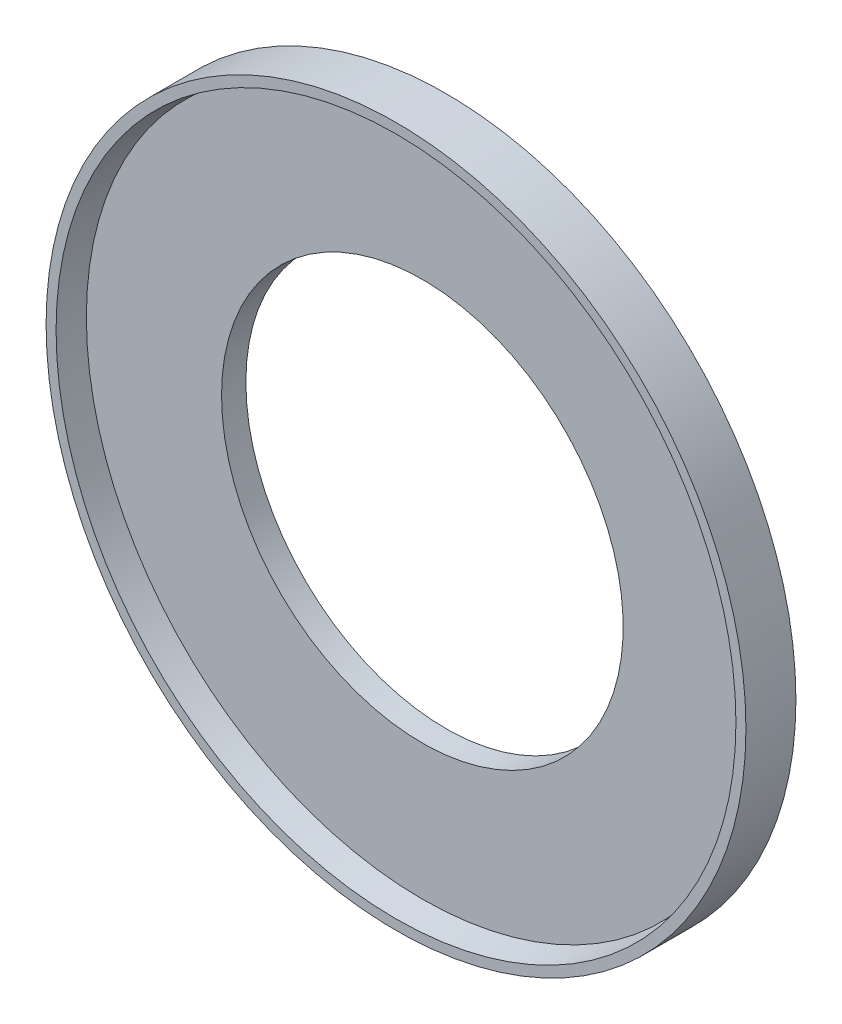
from build123d import *


with BuildPart() as part:
    # 스케치2 → 회전1 (revolve)
    with BuildSketch(Plane(origin=(0, 0, 0), x_dir=(1, 0, 0), z_dir=(0, 1, 0)), mode=Mode.PRIVATE) as revolve_1_sk:
        Polygon((6.721415116, -0.472728965), (6.8, -1), (7, -1), (7, 0), (6.7, 0), (6.49543194, -0.272728965), (4.123726656, -0.272728965), (4.085075514, 0), (4.003618071, 0), (4.017267781, -0.472728965), align=None)
    revolve(revolve_1_sk.sketch.rotate(Axis((0, 0, 0), (0, 0, 1)), 180), axis=Axis((0, 0, 0), (0, 0, 1)))


solid = part.part
